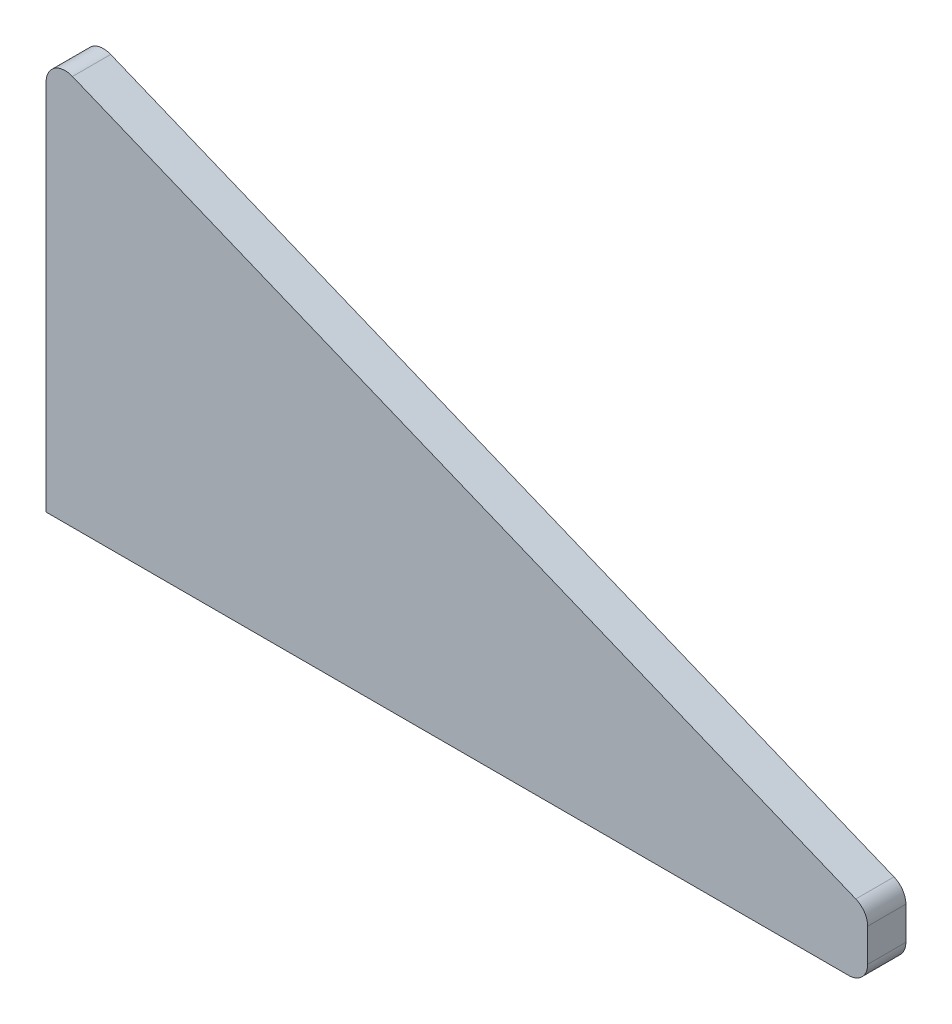
from build123d import *

# Parameters (mm, degrees)
BOSS_EXTRUDE1_DEPTH = 10


with BuildPart() as part:
    # Sketch1 → Boss-Extrude1 (new body)
    with BuildSketch(Plane.XY):
        with BuildLine():
            Line((-78.611020919, 52.384922135), (126.388979081, -31.522054609))
            ThreePointArc((126.388979081, -31.522054609), (128.646483258, -33.362872526), (129.494976829, -36.149446474))
            Line((129.494976829, -36.149446474), (129.494976829, -44.793346711))
            ThreePointArc((129.494976829, -44.793346711), (128.030510735, -48.328880617), (124.494976829, -49.793346711))
            Line((124.494976829, -49.793346711), (-85.505023171, -49.793346711))
            Line((-85.505023171, -49.793346711), (-85.505023171, 47.75753027))
            ThreePointArc((-85.505023171, 47.75753027), (-83.29159712, 51.909036699), (-78.611020919, 52.384922135))
        make_face()
    extrude(amount=BOSS_EXTRUDE1_DEPTH)


solid = part.part
